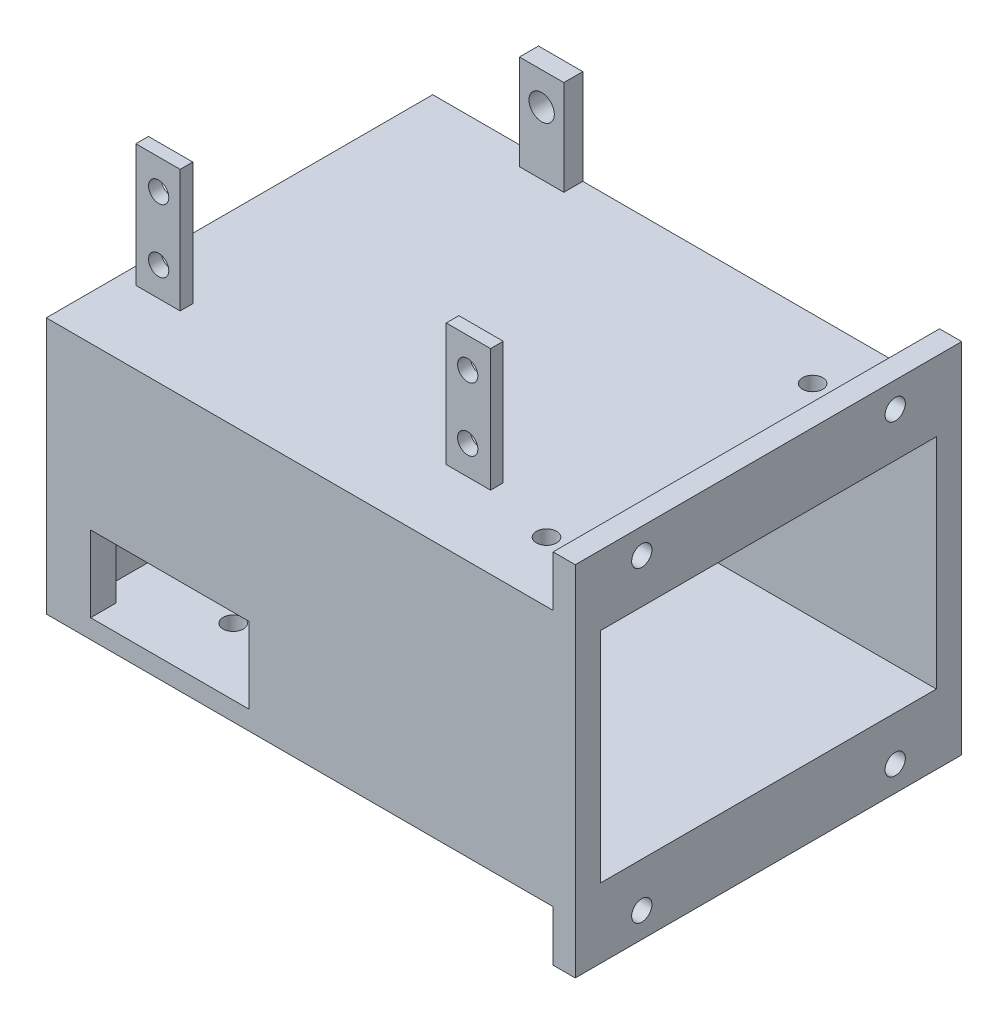
from build123d import *

# Parameters (mm, degrees)
SKETCH1_W                = 151
SKETCH1_H                = 61
SKETCH1_W_2              = 143
SKETCH1_H_2              = 53
BOSS_EXTRUDE1_DEPTH      = 20.25
SKETCH2_W                = 143
SKETCH2_H                = 53
BOSS_EXTRUDE2_DEPTH      = 3
SKETCH7_W                = 53
SKETCH7_H                = 37.5
CUT_EXTRUDE3_DEPTH       = 4
SKETCH9_W                = 147
SKETCH9_H                = 53
BOSS_EXTRUDE3_DEPTH      = 3
CUT_EXTRUDE4_REACH       = 92.944
SKETCH10_R               = 1.6
SKETCH12_R               = 1.55
CUT_EXTRUDE6_DEPTH       = 100.152975245
SKETCH13_W               = 7
SKETCH13_H               = 19.36
BOSS_EXTRUDE4_DEPTH      = 2
SKETCH16_R               = 1.6
CUT_EXTRUDE7_DEPTH       = 10
SKETCH17_W               = 7
SKETCH17_H               = 15
SKETCH17_R               = 2
BOSS_EXTRUDE5_DEPTH      = 3
SKETCH18_R               = 1.6
CUT_EXTRUDE8_DEPTH       = 10
SKETCH19_W               = 25
SKETCH19_H               = 12
CUT_EXTRUDE9_DEPTH       = 105.834164756
SKETCH20_W               = 7
SKETCH20_H               = 61
BOSS_EXTRUDE6_DEPTH      = 8
CUT_EXTRUDE10_REACH      = 96.336
SKETCH21_R               = 1.6
CUT_EXTRUDE11_DEPTH      = 91.550826059
CUT_EXTRUDE11_DEPTH_BACK = 91.550826059
SKETCH22_W               = 75.430215925
SKETCH22_H               = 73.955491088


with BuildPart() as part:
    # Sketch1 → Boss-Extrude1 (new, symmetric)
    with BuildSketch(Plane(origin=(0, 0, 0), x_dir=(1, 0, 0), z_dir=(0, 1, 0))):
        Rectangle(SKETCH1_W, SKETCH1_H)
        Rectangle(SKETCH1_W_2, SKETCH1_H_2, mode=Mode.SUBTRACT)
    extrude(amount=BOSS_EXTRUDE1_DEPTH, both=True)

    # Sketch2 → Boss-Extrude2 (add)
    with BuildSketch(Plane.XZ.offset(20.25)):
        Rectangle(SKETCH2_W, SKETCH2_H)
    extrude(amount=-BOSS_EXTRUDE2_DEPTH)

    # Sketch7 → Cut-Extrude3 (cut)
    with BuildSketch(Plane(origin=(75.5, 0, 0), x_dir=(0, 0, -1), z_dir=(1, 0, 0))):
        with Locations((0, 1.5)):
            Rectangle(SKETCH7_W, SKETCH7_H)
    extrude(amount=-CUT_EXTRUDE3_DEPTH, mode=Mode.SUBTRACT)

    # Sketch9 → Boss-Extrude3 (add)
    with BuildSketch(Plane(origin=(0, 20.25, 0), x_dir=(1, 0, 0), z_dir=(0, 1, 0))):
        with Locations((2, 0)):
            Rectangle(SKETCH9_W, SKETCH9_H)
    extrude(amount=-BOSS_EXTRUDE3_DEPTH)

    # Sketch10 → Cut-Extrude4 (cut, up to next)
    with BuildSketch(Plane(origin=(0, 20.25, 0), x_dir=(1, 0, 0), z_dir=(0, 1, 0)), mode=Mode.PRIVATE) as cut_extrude4_sk1:
        with Locations(Location((60, 24.1, 0), (0, 0, 270))):
            Circle(SKETCH10_R)
    cut_extrude4_tool1 = extrude(cut_extrude4_sk1.sketch, amount=-CUT_EXTRUDE4_REACH, mode=Mode.PRIVATE) & part.part
    # Sketch10 → Cut-Extrude4 (cut, up to next)
    with BuildSketch(Plane(origin=(0, 20.25, 0), x_dir=(1, 0, 0), z_dir=(0, 1, 0)), mode=Mode.PRIVATE) as cut_extrude4_sk2:
        with Locations(Location((60, -24.1, 0), (0, 0, 90))):
            Circle(SKETCH10_R)
    cut_extrude4_tool2 = extrude(cut_extrude4_sk2.sketch, amount=-CUT_EXTRUDE4_REACH, mode=Mode.PRIVATE) & part.part
    # Sketch10 → Cut-Extrude4 (cut, up to next)
    with BuildSketch(Plane(origin=(0, 20.25, 0), x_dir=(1, 0, 0), z_dir=(0, 1, 0)), mode=Mode.PRIVATE) as cut_extrude4_sk3:
        with Locations(Location((-6.04, 21, 0), (0, 0, 270))):
            Circle(SKETCH10_R)
    cut_extrude4_tool3 = extrude(cut_extrude4_sk3.sketch, amount=-CUT_EXTRUDE4_REACH, mode=Mode.PRIVATE) & part.part
    # Sketch10 → Cut-Extrude4 (cut, up to next)
    with BuildSketch(Plane(origin=(0, 20.25, 0), x_dir=(1, 0, 0), z_dir=(0, 1, 0)), mode=Mode.PRIVATE) as cut_extrude4_sk4:
        with Locations(Location((-6.04, -21, 0), (0, 0, 90))):
            Circle(SKETCH10_R)
    cut_extrude4_tool4 = extrude(cut_extrude4_sk4.sketch, amount=-CUT_EXTRUDE4_REACH, mode=Mode.PRIVATE) & part.part
    add(cut_extrude4_tool1.solids().sort_by_distance((60, 20.25, -24.1))[0], mode=Mode.SUBTRACT)
    add(cut_extrude4_tool2.solids().sort_by_distance((60, 20.25, 24.1))[0], mode=Mode.SUBTRACT)
    add(cut_extrude4_tool3.solids().sort_by_distance((-6.04, 20.25, -21))[0], mode=Mode.SUBTRACT)
    add(cut_extrude4_tool4.solids().sort_by_distance((-6.04, 20.25, 21))[0], mode=Mode.SUBTRACT)

    # Sketch12 → Cut-Extrude6 (cut, through all)
    with BuildSketch(Plane.XY.offset(30.5)):
        with Locations((67.445205237, 4.65)):
            Circle(SKETCH12_R)
        with Locations((67.445205237, -4.65)):
            Circle(SKETCH12_R)
        with Locations((17.545205237, 4.65)):
            Circle(SKETCH12_R)
        with Locations((17.545205237, -4.65)):
            Circle(SKETCH12_R)
    extrude(amount=-CUT_EXTRUDE6_DEPTH, mode=Mode.SUBTRACT)

    # Sketch13 → Boss-Extrude4 (add)
    with BuildSketch(Plane.XY.offset(17)):
        with Locations((-69.37, 29.93)):
            Rectangle(SKETCH13_W, SKETCH13_H)
    boss_extrude4 = extrude(amount=BOSS_EXTRUDE4_DEPTH)

    # Sketch16 → Cut-Extrude7 (cut)
    with BuildSketch(Plane.XY.offset(19)):
        with Locations((-69.262241782, 24.85)):
            Circle(SKETCH16_R)
        with Locations((-69.262241782, 34.85)):
            Circle(SKETCH16_R)
    cut_extrude7 = extrude(amount=-CUT_EXTRUDE7_DEPTH, mode=Mode.SUBTRACT)

    # Mirror1: Boss-Extrude4, Cut-Extrude7 across plane
    add(boss_extrude4.mirror(Plane(origin=(-44.87, 0, 0), x_dir=(0, 0, 1), z_dir=(1, 0, 0))))
    add(cut_extrude7.mirror(Plane(origin=(-44.87, 0, 0), x_dir=(0, 0, 1), z_dir=(1, 0, 0))), mode=Mode.SUBTRACT)

    # Sketch17 → Boss-Extrude5 (add)
    with BuildSketch(Plane(origin=(0, 0, -30.5), x_dir=(-1, 0, 0), z_dir=(0, 0, -1))):
        with Locations((55.31, 27.75)):
            Rectangle(SKETCH17_W, SKETCH17_H)
        with Locations((55.31, 30.15)):
            Circle(SKETCH17_R, mode=Mode.SUBTRACT)
    extrude(amount=-BOSS_EXTRUDE5_DEPTH)

    # Sketch18 → Cut-Extrude8 (cut)
    with BuildSketch(Plane.XZ.offset(20.25)):
        with Locations(Location((-56.5, 20, 0), (0, 0, 270))):
            Circle(SKETCH18_R)
        with Locations(Location((-56.5, -20, 0), (0, 0, 270))):
            Circle(SKETCH18_R)
    extrude(amount=-CUT_EXTRUDE8_DEPTH, mode=Mode.SUBTRACT)

    # Sketch19 → Cut-Extrude9 (cut, through all)
    with BuildSketch(Plane.XY.offset(30.5)):
        with Locations((-56, -11.25)):
            Rectangle(SKETCH19_W, SKETCH19_H)
    extrude(amount=-CUT_EXTRUDE9_DEPTH, mode=Mode.SUBTRACT)

    # Sketch20 → Boss-Extrude6 (add)
    with BuildSketch(Plane(origin=(0, 20.25, 0), x_dir=(1, 0, 0), z_dir=(0, 1, 0))):
        with Locations((8, 0)):
            Rectangle(SKETCH20_W, SKETCH20_H)
    boss_extrude6 = extrude(amount=BOSS_EXTRUDE6_DEPTH)

    # Sketch21 → Cut-Extrude10 (cut, up to next)
    with BuildSketch(Plane.ZY.offset(-4.5), mode=Mode.PRIVATE) as cut_extrude10_sk1:
        with Locations((-20, 24.25)):
            Circle(SKETCH21_R)
    cut_extrude10_tool1 = extrude(cut_extrude10_sk1.sketch, amount=-CUT_EXTRUDE10_REACH, mode=Mode.PRIVATE) & part.part
    # Sketch21 → Cut-Extrude10 (cut, up to next)
    with BuildSketch(Plane.ZY.offset(-4.5), mode=Mode.PRIVATE) as cut_extrude10_sk2:
        with Locations((20, 24.25)):
            Circle(SKETCH21_R)
    cut_extrude10_tool2 = extrude(cut_extrude10_sk2.sketch, amount=-CUT_EXTRUDE10_REACH, mode=Mode.PRIVATE) & part.part
    cut_extrude10_1 = cut_extrude10_tool1.solids().sort_by_distance((4.5, 24.25, -20))[0]
    add(cut_extrude10_1, mode=Mode.SUBTRACT)
    cut_extrude10_2 = cut_extrude10_tool2.solids().sort_by_distance((4.5, 24.25, 20))[0]
    add(cut_extrude10_2, mode=Mode.SUBTRACT)
    cut_extrude10 = cut_extrude10_1 + cut_extrude10_2  # Cut-Extrude10 as one shape, for the pattern or mirror that repeats it

    # Mirror2: Boss-Extrude6, Cut-Extrude10 across plane
    add(boss_extrude6.mirror(Plane.ZX))
    add(cut_extrude10.mirror(Plane.ZX), mode=Mode.SUBTRACT)

    # Sketch22 → Cut-Extrude11 (cut, two sides: drawn at the far end of the back side and taken through both)
    with BuildSketch(Plane(origin=(0, 0, 0), x_dir=(1, 0, 0), z_dir=(0, 1, 0)).offset(-CUT_EXTRUDE11_DEPTH_BACK)):
        with Locations((45.715107962, 4.7681e-05)):
            Rectangle(SKETCH22_W, SKETCH22_H)
    extrude(amount=CUT_EXTRUDE11_DEPTH + CUT_EXTRUDE11_DEPTH_BACK, mode=Mode.SUBTRACT)


solid = part.part
